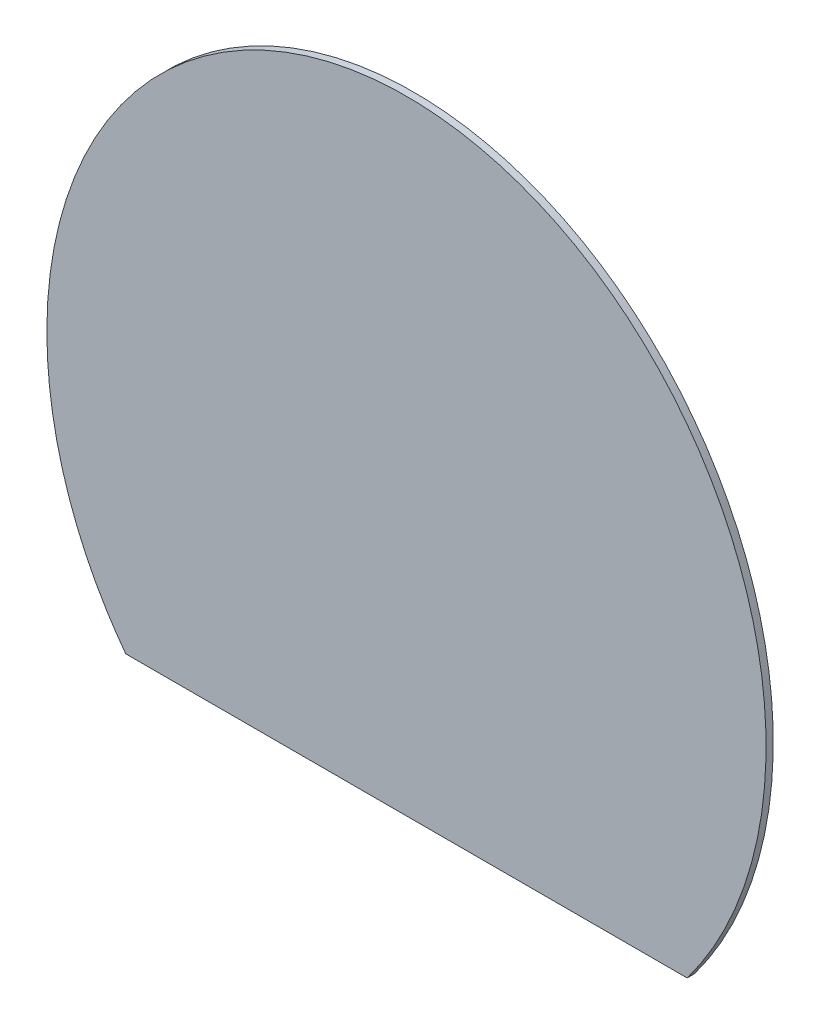
from build123d import *

# Parameters (mm, degrees)
RESSALTO_EXTRUS_O1_DEPTH = 1.5


with BuildPart() as part:
    # Esboço1 → Ressalto-extrusão1 (new body)
    with BuildSketch(Plane.XY):
        with BuildLine():
            Line((-58.546856235, -50), (58.546856235, -50))
            add(Edge.make_bspline(
                [(58.546856235, -50), (156.12494996, 80), (0, 80), (-156.12494996, 80), (-58.546856235, -50)],
                knots=[4.037257447, 4.037257447, 4.037257447, 6.283185307, 6.283185307, 8.529113167, 8.529113167, 8.529113167], degree=2, weights=[1, 0.433012702, 1, 0.433012702, 1]))
        make_face()
    extrude(amount=RESSALTO_EXTRUS_O1_DEPTH)


solid = part.part
